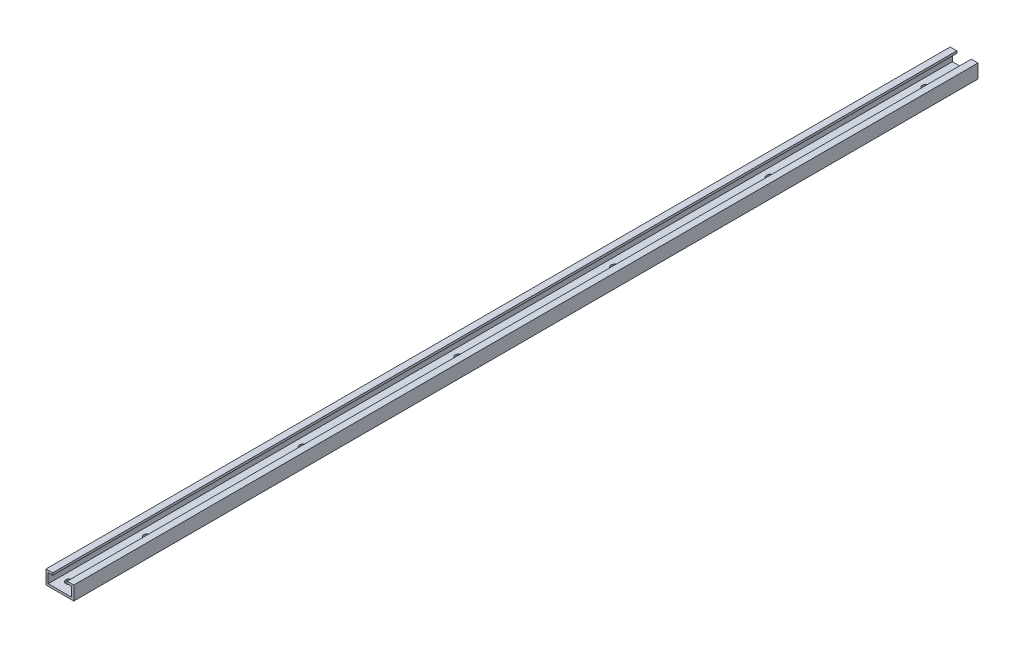
from build123d import *

# Parameters (mm, degrees)
BOSS_EXTRU_1_DEPTH         = 813
D_GAGEMENT_M61_D           = 6.6
R_P_TITION_LIN_AIRE1_COUNT = 12
R_P_TITION_LIN_AIRE1_PITCH = 70


with BuildPart() as part:
    # Esquisse1 → Boss.-Extru.1 (new body)
    with BuildSketch(Plane.XY):
        Polygon((-6.5, 12.5), (-12.5, 12.5), (-12.5, 0), (12.5, 0), (12.5, 12.5), (6.5, 12.5), (6.5, 10.5), (10.5, 10.5), (10.5, 2), (-10.5, 2), (-10.5, 10.5), (-6.5, 10.5), align=None)
    extrude(amount=BOSS_EXTRU_1_DEPTH)

    # Dégagement M61 (through all)
    with Locations(Plane(origin=(0, 0, 0), x_dir=(-1, 0, 0), z_dir=(0, -1, 0))):
        with Locations((2.40627347, -801.806864395)):
            d_gagement_m61 = Hole(D_GAGEMENT_M61_D / 2)

    # Répétition linéaire1: Dégagement M61 ×12, 5 skipped
    with Locations(*[(0, 0, -i * R_P_TITION_LIN_AIRE1_PITCH) for i in range(1, R_P_TITION_LIN_AIRE1_COUNT) if i not in (2, 4, 6, 8, 10)]):
        add(d_gagement_m61, mode=Mode.SUBTRACT)


solid = part.part
